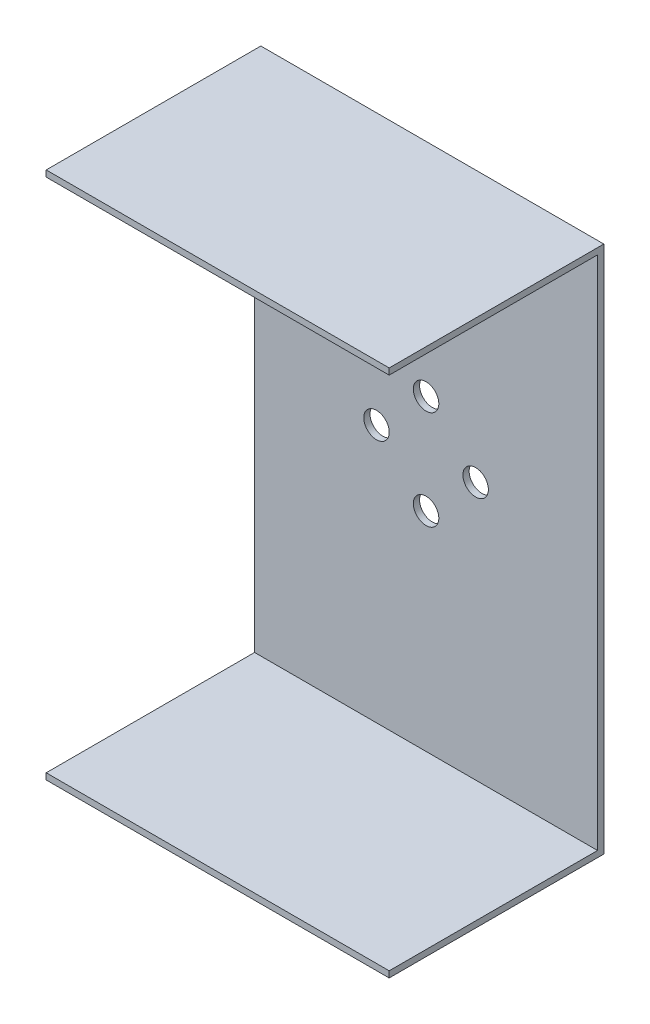
from build123d import *

# Parameters (mm, degrees)
BOSS_EXTRUDE1_DEPTH = 87.89068
SKETCH2_R           = 3.2639
CUT_EXTRUDE1_DEPTH  = 1.6002


with BuildPart() as part:
    # Sketch1 → Boss-Extrude1 (new body)
    with BuildSketch(Plane(origin=(0, 0, 0), x_dir=(0, 0, -1), z_dir=(1, 0, 0))):
        Polygon((0, 0), (0, -1.6002), (53.3998, -1.6002), (53.3998, -133.7877), (0, -133.7877), (0, -135.3879), (55, -135.3879), (55, 0), align=None)
    extrude(amount=BOSS_EXTRUDE1_DEPTH)

    # Sketch2 → Cut-Extrude1 (cut)
    with BuildSketch(Plane.XY.offset(-53.3998)):
        with Locations((43.94534, -54.99395)):
            Circle(SKETCH2_R)
        with Locations((43.94534, -80.39395)):
            Circle(SKETCH2_R)
        with Locations((31.24534, -67.69395)):
            Circle(SKETCH2_R)
        with Locations((56.64534, -67.69395)):
            Circle(SKETCH2_R)
    extrude(amount=-CUT_EXTRUDE1_DEPTH, mode=Mode.SUBTRACT)


solid = part.part
